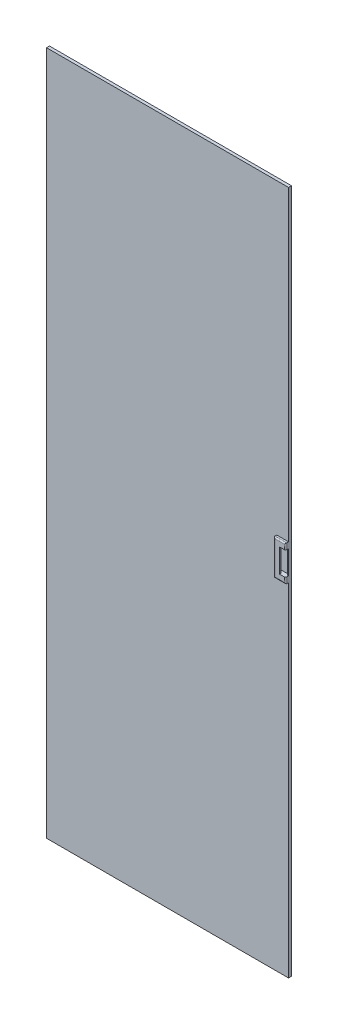
from build123d import *

# Parameters (mm, degrees)
SKETCH1_W           = 520.7
SKETCH1_H           = 1473.2
BOSS_EXTRUDE1_DEPTH = 6.35
BOSS_EXTRUDE2_DEPTH = 6.35
SKETCH2_4_W         = 10.0763546
SKETCH2_4_H         = 50.817669104
CUT_EXTRUDE1_DEPTH  = 3.175
SKETCH4_W           = 4.7625
SKETCH4_H           = 50.817669104
CUT_EXTRUDE2_DEPTH  = 6.35
FILLET1_R           = 2.54
FILLET2_R           = 2.54


with BuildPart() as part:
    # Sketch1 → Boss-Extrude1 (new body)
    with BuildSketch(Plane.XY):
        Rectangle(SKETCH1_W, SKETCH1_H)
    extrude(amount=BOSS_EXTRUDE1_DEPTH)

    # Sketch2 → Boss-Extrude2 (add)
    with BuildSketch(Plane.XY.offset(6.35)):
        Polygon((234.95, 0), (260.35, 0), (260.35, 12.620459264), (257.7263546, 12.620459264), (247.65, 12.620459264), (247.65, 63.438128368), (257.7263546, 63.438128368), (260.35, 63.438128368), (260.35, 76.2), (234.95, 76.2), align=None)
    extrude(amount=BOSS_EXTRUDE2_DEPTH)

    # Sketch2<4> → Cut-Extrude1 (cut)
    with BuildSketch(Plane.XY.offset(6.35)):
        with Locations((252.6881773, 38.029293816)):
            Rectangle(SKETCH2_4_W, SKETCH2_4_H)
    extrude(amount=-CUT_EXTRUDE1_DEPTH, mode=Mode.SUBTRACT)

    # Sketch4 → Cut-Extrude2 (cut)
    with BuildSketch(Plane(origin=(247.65, 0, 0), x_dir=(0, 0, -1), z_dir=(1, 0, 0))):
        with Locations((-5.55625, 38.029293816)):
            Rectangle(SKETCH4_W, SKETCH4_H)
    extrude(amount=-CUT_EXTRUDE2_DEPTH, mode=Mode.SUBTRACT)

    # Fillet1
    fillet1_edges = [part.edges().sort_by_distance(p)[0] for p in [
        (247.65, 38.029293816, 7.9375),
    ]]
    fillet(fillet1_edges, radius=FILLET1_R)

    # Fillet2
    fillet2_edges = [part.edges().sort_by_distance(p)[0] for p in [
        (260.35, 69.819064184, 12.7),
        (260.35, 6.310229632, 12.7),
        (247.65, 0, 12.7),
        (247.65, 76.2, 12.7),
        (234.95, 38.1, 12.7),
    ]]
    fillet(fillet2_edges, radius=FILLET2_R)


solid = part.part
